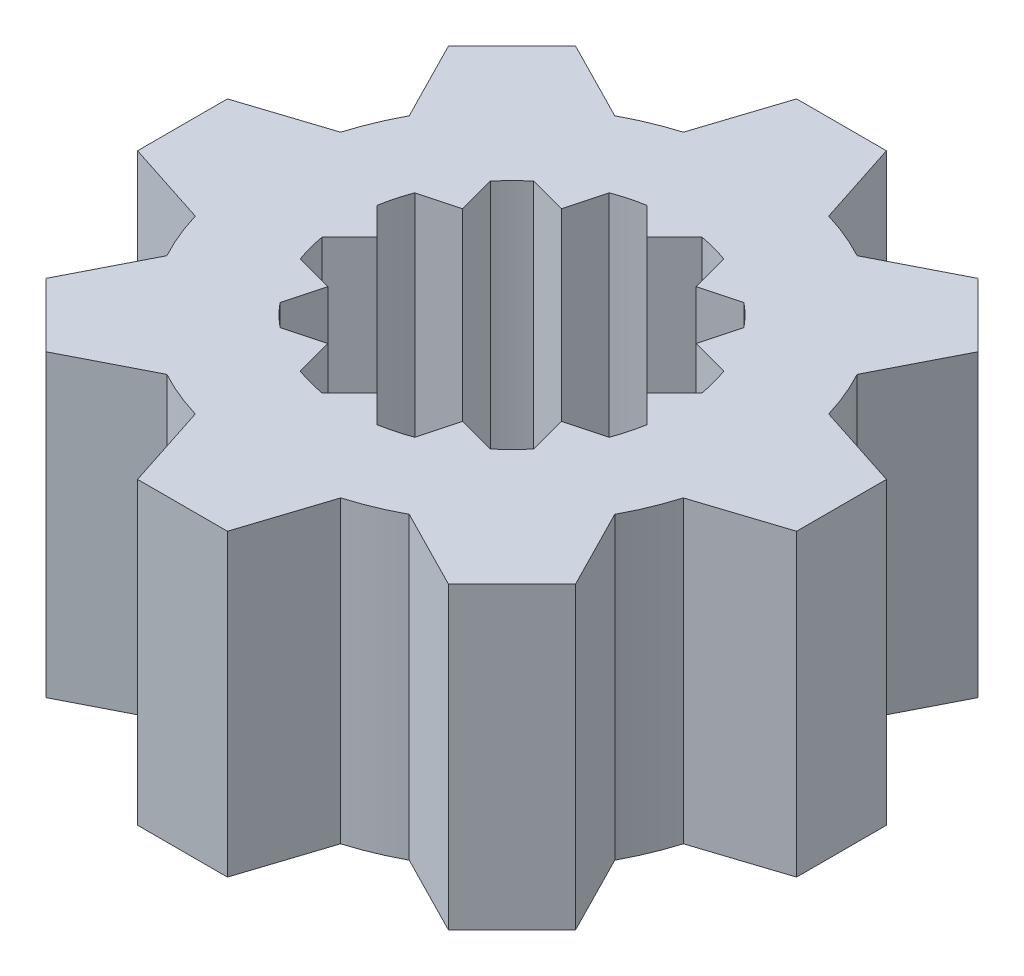
from build123d import *

# Parameters (mm, degrees)
BOSS_EXTRUDE1_DEPTH = 10


with BuildPart() as part:
    # Sketch1 → Boss-Extrude1 (new body)
    with BuildSketch(Plane(origin=(0, 0, 0), x_dir=(1, 0, 0), z_dir=(0, 1, 0))):
        with BuildLine():
            Line((-1.5, 11), (1.5, 11))
            Line((1.5, 11), (2.425924848, 8.146464793))
            ThreePointArc((2.425924848, 8.146464793), (3.252809175, 7.852976026), (4.045032587, 7.475808409))
            Line((4.045032587, 7.475808409), (6.717514421, 8.838834765))
            Line((6.717514421, 8.838834765), (8.838834765, 6.717514421))
            Line((8.838834765, 6.717514421), (7.475808409, 4.045032587))
            ThreePointArc((7.475808409, 4.045032587), (7.852976026, 3.252809175), (8.146464793, 2.425924848))
            Line((8.146464793, 2.425924848), (11, 1.5))
            Line((11, 1.5), (11, -1.5))
            Line((11, -1.5), (8.146464793, -2.425924848))
            ThreePointArc((8.146464793, -2.425924848), (7.852976026, -3.252809175), (7.475808409, -4.045032587))
            Line((7.475808409, -4.045032587), (8.838834765, -6.717514421))
            Line((8.838834765, -6.717514421), (6.717514421, -8.838834765))
            Line((6.717514421, -8.838834765), (4.045032587, -7.475808409))
            ThreePointArc((4.045032587, -7.475808409), (3.252809175, -7.852976026), (2.425924848, -8.146464793))
            Line((2.425924848, -8.146464793), (1.5, -11))
            Line((1.5, -11), (-1.5, -11))
            Line((-1.5, -11), (-2.425924848, -8.146464793))
            ThreePointArc((-2.425924848, -8.146464793), (-3.252809175, -7.852976026), (-4.045032587, -7.475808409))
            Line((-4.045032587, -7.475808409), (-6.717514421, -8.838834765))
            Line((-6.717514421, -8.838834765), (-8.838834765, -6.717514421))
            Line((-8.838834765, -6.717514421), (-7.475808409, -4.045032587))
            ThreePointArc((-7.475808409, -4.045032587), (-7.852976026, -3.252809175), (-8.146464793, -2.425924848))
            Line((-8.146464793, -2.425924848), (-11, -1.5))
            Line((-11, -1.5), (-11, 1.5))
            Line((-11, 1.5), (-8.146464793, 2.425924848))
            ThreePointArc((-8.146464793, 2.425924848), (-7.852976026, 3.252809175), (-7.475808409, 4.045032587))
            Line((-7.475808409, 4.045032587), (-8.838834765, 6.717514421))
            Line((-8.838834765, 6.717514421), (-6.717514421, 8.838834765))
            Line((-6.717514421, 8.838834765), (-4.045032587, 7.475808409))
            ThreePointArc((-4.045032587, 7.475808409), (-3.252809175, 7.852976026), (-2.425924848, 8.146464793))
            Line((-2.425924848, 8.146464793), (-1.5, 11))
        make_face()
        with BuildLine():
            Line((0, 4.5), (-0.922144385, 5.422144385))
            ThreePointArc((-0.922144385, 5.422144385), (-1.423504748, 5.312592045), (-1.912471729, 5.156786973))
            Line((-1.912471729, 5.156786973), (-2.25, 3.897114317))
            Line((-2.25, 3.897114317), (-3.509672656, 4.234642588))
            ThreePointArc((-3.509672656, 4.234642588), (-3.889087297, 3.889087297), (-4.234642588, 3.509672656))
            Line((-4.234642588, 3.509672656), (-3.897114317, 2.25))
            Line((-3.897114317, 2.25), (-5.156786973, 1.912471729))
            ThreePointArc((-5.156786973, 1.912471729), (-5.312592045, 1.423504748), (-5.422144385, 0.922144385))
            Line((-5.422144385, 0.922144385), (-4.5, 0))
            Line((-4.5, 0), (-5.422144385, -0.922144385))
            ThreePointArc((-5.422144385, -0.922144385), (-5.312592045, -1.423504748), (-5.156786973, -1.912471729))
            Line((-5.156786973, -1.912471729), (-3.897114317, -2.25))
            Line((-3.897114317, -2.25), (-4.234642588, -3.509672656))
            ThreePointArc((-4.234642588, -3.509672656), (-3.889087297, -3.889087297), (-3.509672656, -4.234642588))
            Line((-3.509672656, -4.234642588), (-2.25, -3.897114317))
            Line((-2.25, -3.897114317), (-1.912471729, -5.156786973))
            ThreePointArc((-1.912471729, -5.156786973), (-1.423504748, -5.312592045), (-0.922144385, -5.422144385))
            Line((-0.922144385, -5.422144385), (0, -4.5))
            Line((0, -4.5), (0.922144385, -5.422144385))
            ThreePointArc((0.922144385, -5.422144385), (1.423504748, -5.312592045), (1.912471729, -5.156786973))
            Line((1.912471729, -5.156786973), (2.25, -3.897114317))
            Line((2.25, -3.897114317), (3.509672656, -4.234642588))
            ThreePointArc((3.509672656, -4.234642588), (3.889087297, -3.889087297), (4.234642588, -3.509672656))
            Line((4.234642588, -3.509672656), (3.897114317, -2.25))
            Line((3.897114317, -2.25), (5.156786973, -1.912471729))
            ThreePointArc((5.156786973, -1.912471729), (5.312592045, -1.423504748), (5.422144385, -0.922144385))
            Line((5.422144385, -0.922144385), (4.5, 0))
            Line((4.5, 0), (5.422144385, 0.922144385))
            ThreePointArc((5.422144385, 0.922144385), (5.312592045, 1.423504748), (5.156786973, 1.912471729))
            Line((5.156786973, 1.912471729), (3.897114317, 2.25))
            Line((3.897114317, 2.25), (4.234642588, 3.509672656))
            ThreePointArc((4.234642588, 3.509672656), (3.889087297, 3.889087297), (3.509672656, 4.234642588))
            Line((3.509672656, 4.234642588), (2.25, 3.897114317))
            Line((2.25, 3.897114317), (1.912471729, 5.156786973))
            ThreePointArc((1.912471729, 5.156786973), (1.423504748, 5.312592045), (0.922144385, 5.422144385))
            Line((0.922144385, 5.422144385), (0, 4.5))
        make_face(mode=Mode.SUBTRACT)
    extrude(amount=BOSS_EXTRUDE1_DEPTH)


solid = part.part
